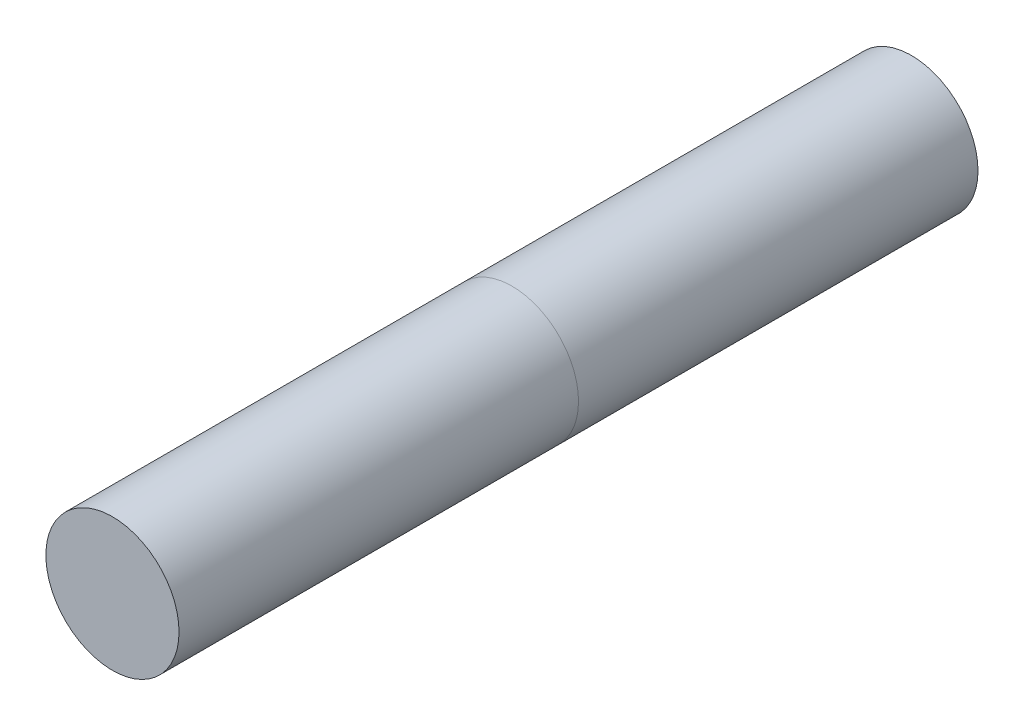
from build123d import *

# Parameters (mm, degrees)
SKETCH1_R           = 2.5
BOSS_EXTRUDE1_DEPTH = 15
SKETCH2_R           = 2.5
BOSS_EXTRUDE2_DEPTH = 15


with BuildPart() as part:
    # Sketch1 → Boss-Extrude1 (new body)
    with BuildSketch(Plane.XY):
        Circle(SKETCH1_R)
    extrude(amount=BOSS_EXTRUDE1_DEPTH)


with BuildPart() as body_2:
    # Sketch2 → Boss-Extrude2 (new body)
    with BuildSketch(Plane.XY.offset(15)):
        Circle(SKETCH2_R)
    extrude(amount=BOSS_EXTRUDE2_DEPTH)


solid = Compound([part.part, body_2.part])
